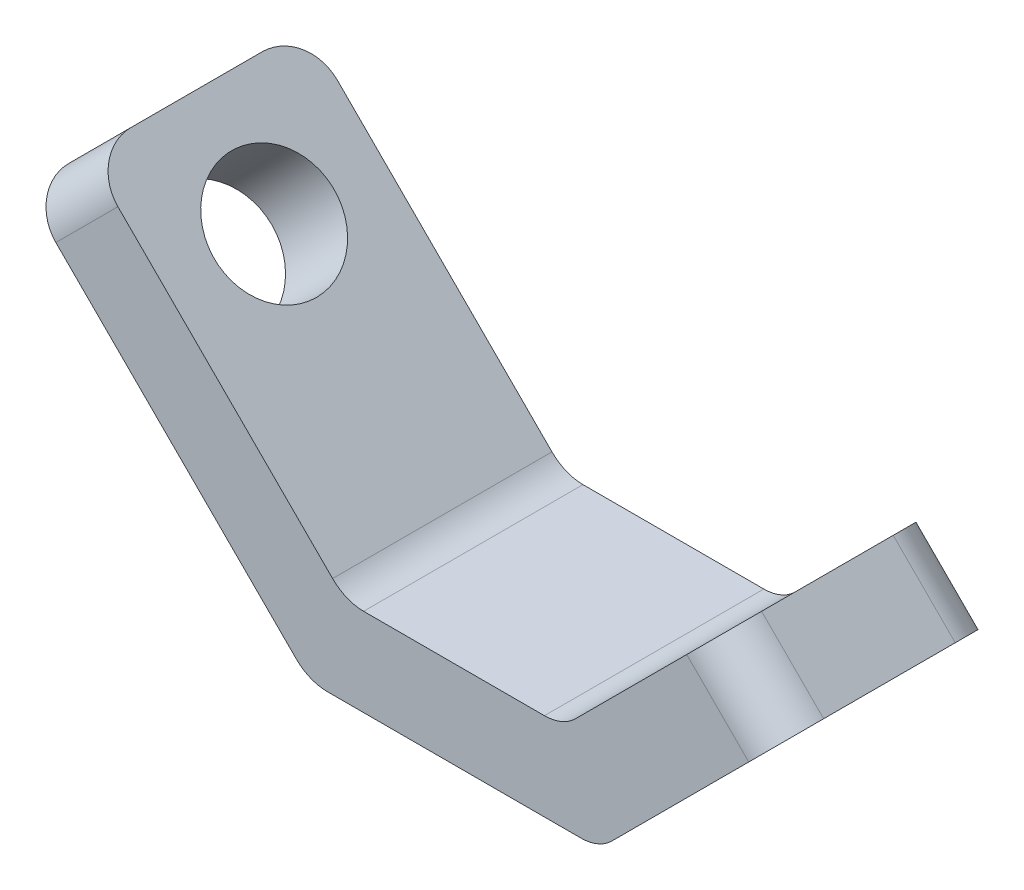
from build123d import *

# Parameters (mm, degrees)
EXTRUDE_1_DEPTH          = 7.5
CUT_EXTRUDE_1_DEPTH      = 41.653128295
CUT_EXTRUDE_1_DEPTH_BACK = 41.653128295
SKETCH_2_R               = 4.1
CUT_EXTRUDE_2_DEPTH      = 46.227204203
CUT_EXTRUDE_2_DEPTH_BACK = 46.227204203
SKETCH_3_R               = 4.1
FILLET_1_R               = 3


with BuildPart() as part:
    # ｽｹｯﾁ1 → ﾎﾞｽ - 押し出し1 (new, symmetric)
    with BuildSketch(Plane.XY):
        Polygon((0, 0), (-19.435028843, 19.435028843), (-15.192388155, 23.67766953), (2.485281374, 6), (17.334523779, 6), (27.941125497, 16.606601718), (32.183766184, 12.363961031), (19.819805153, 0), align=None)
    extrude(amount=EXTRUDE_1_DEPTH, both=True)

    # ｽｹｯﾁ2 → ｶｯﾄ - 押し出し1 (cut, two sides: drawn at the far end of the back side and taken through both)
    with BuildSketch(Plane(origin=(0, 0, 0), x_dir=(0, 0, 1), z_dir=(-0.7071067811865487, -0.7071067811865464, 0)).offset(-CUT_EXTRUDE_1_DEPTH_BACK)):
        with Locations(Location((0, 19.985281374, 0), (0, 0, 270))):
            Circle(SKETCH_2_R)
    extrude(amount=CUT_EXTRUDE_1_DEPTH + CUT_EXTRUDE_1_DEPTH_BACK, mode=Mode.SUBTRACT)

    # ｽｹｯﾁ3 → ｶｯﾄ - 押し出し2 (cut, two sides: drawn at the far end of the back side and taken through both)
    with BuildSketch(Plane(origin=(9.909902577, -9.909902577, 0), x_dir=(0, 0, -1), z_dir=(0.707106781186549, -0.7071067811865461, 0)).offset(-CUT_EXTRUDE_2_DEPTH_BACK)):
        with Locations(Location((0, 24, 0), (0, 0, 90))):
            Circle(SKETCH_3_R)
    extrude(amount=CUT_EXTRUDE_2_DEPTH + CUT_EXTRUDE_2_DEPTH_BACK, mode=Mode.SUBTRACT)

    # ﾌｨﾚｯﾄ1
    fillet_1_edges = [part.edges().sort_by_distance(p)[0] for p in [
        (30.062445841, 14.485281374, -7.5),
        (30.062445841, 14.485281374, 7.5),
        (0, 0, 0),
        (2.485281374, 6, 0),
        (17.334523779, 6, 0),
        (19.819805153, 0, 0),
        (-17.313708499, 21.556349186, 7.5),
        (-17.313708499, 21.556349186, -7.5),
    ]]
    fillet(fillet_1_edges, radius=FILLET_1_R)


solid = part.part
